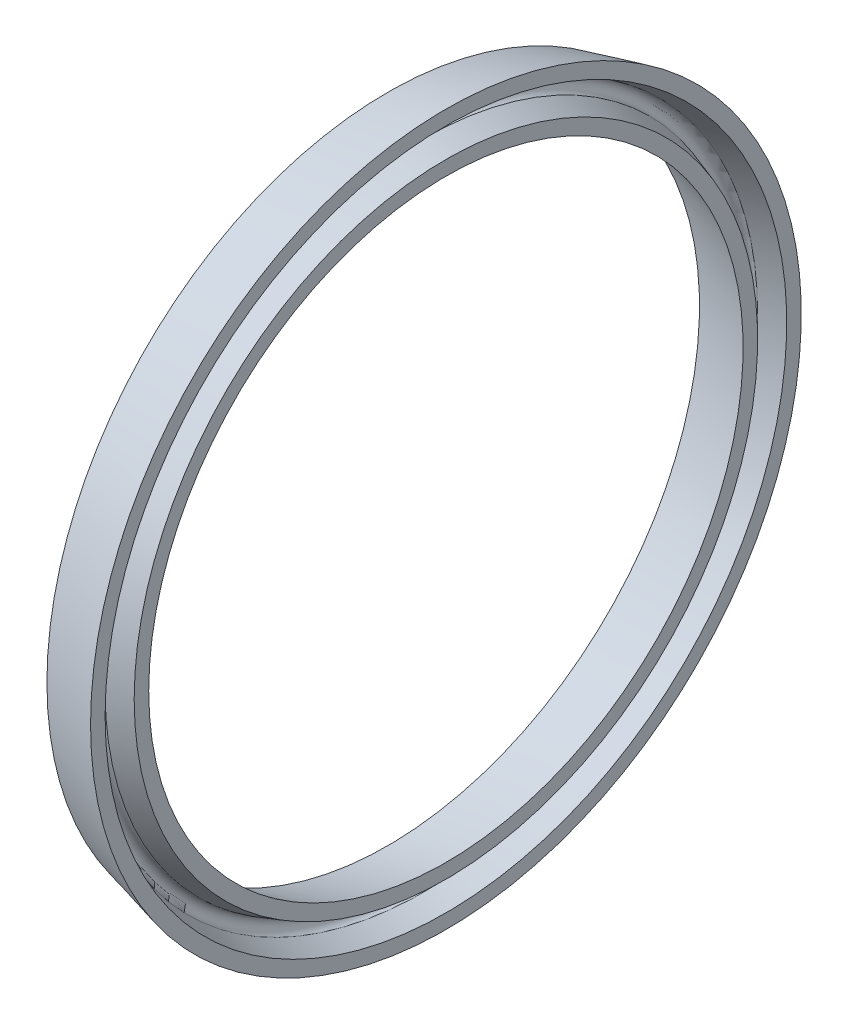
from build123d import *


with BuildPart() as part:
    # Sketch1 → Revolve1 (revolve)
    with BuildSketch(Plane.XY, mode=Mode.PRIVATE) as revolve1_sk:
        with BuildLine():
            Line((0, 73.31), (-12, 70.31))
            Line((-12, 70.31), (-12, 64.31))
            Line((-12, 64.31), (0, 61.31))
            Line((0, 61.31), (0, 64.31))
            Line((0, 64.31), (-4.5, 65.81))
            ThreePointArc((-4.5, 65.81), (-6, 67.31), (-4.5, 68.81))
            Line((-4.5, 68.81), (0, 70.31))
            Line((0, 70.31), (0, 73.31))
        make_face()
    revolve(revolve1_sk.sketch.rotate(Axis((0, 0, 0), (1, 0, 0)), 90), axis=Axis((0, 0, 0), (1, 0, 0)))


solid = part.part
